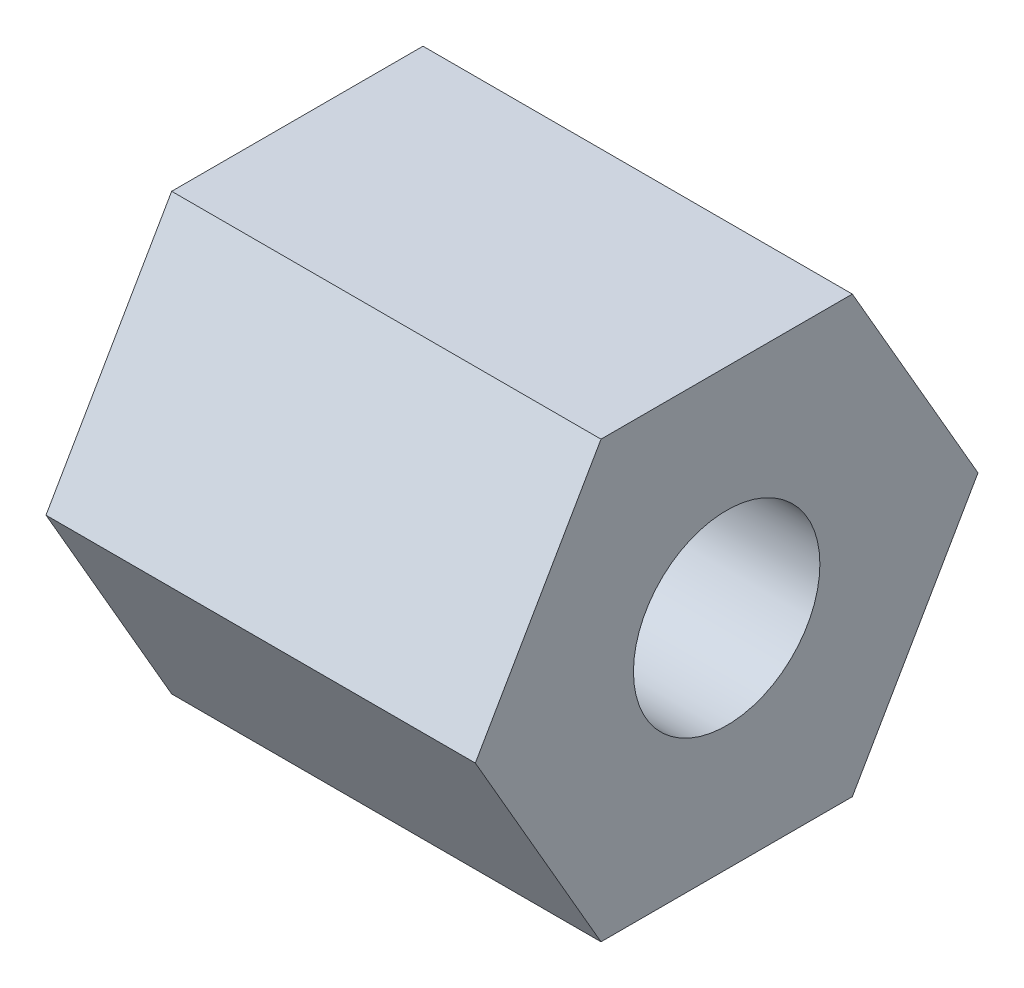
from build123d import *

# Parameters (mm, degrees)
BOSS_EXTRUDE1_DEPTH = 5.03
SKETCH2_R           = 1.0922
CUT_EXTRUDE1_DEPTH  = 7.361870794


with BuildPart() as part:
    # Sketch1 → Boss-Extrude1 (new body)
    with BuildSketch(Plane(origin=(0, 0, 0), x_dir=(0, 0, -1), z_dir=(1, 0, 0))):
        Polygon((2.944486373, 0), (1.472243186, 2.55), (-1.472243186, 2.55), (-2.944486373, 0), (-1.472243186, -2.55), (1.472243186, -2.55), align=None)
    extrude(amount=BOSS_EXTRUDE1_DEPTH)

    # Sketch2 → Cut-Extrude1 (cut, through all)
    with BuildSketch(Plane(origin=(5.03, 0, 0), x_dir=(0, 0, -1), z_dir=(1, 0, 0))):
        Circle(SKETCH2_R)
    extrude(amount=-CUT_EXTRUDE1_DEPTH, mode=Mode.SUBTRACT)


solid = part.part
